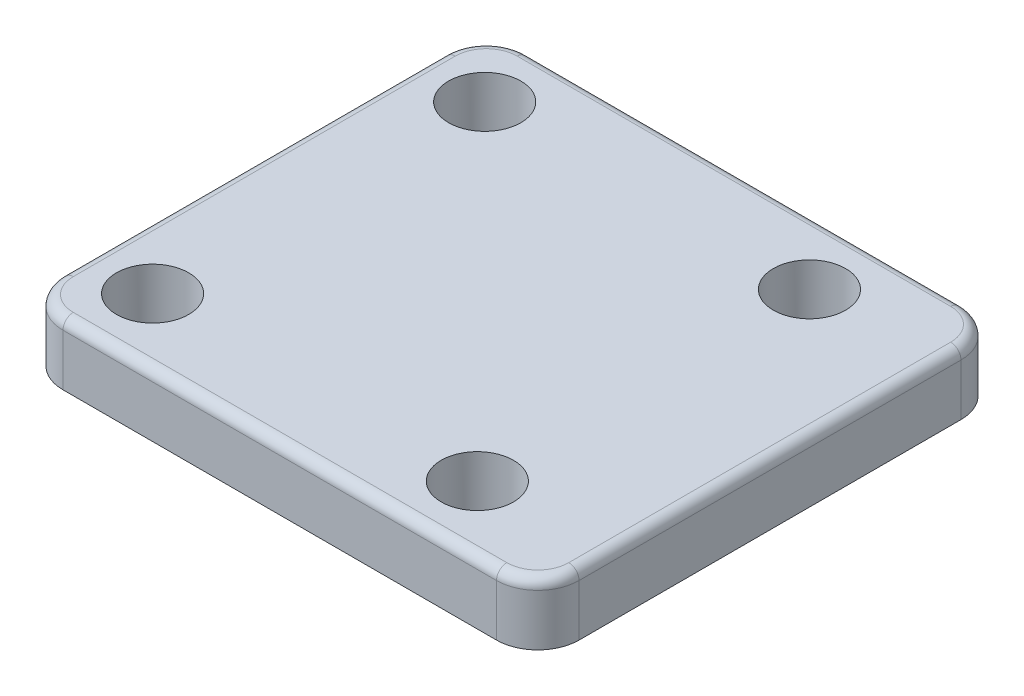
from build123d import *

# Parameters (mm, degrees)
BOSS_EXTRUDE1_DEPTH     = 3
CUT_EXTRUDE2_DEPTH      = 35.165040612
CUT_EXTRUDE2_DEPTH_BACK = 35.165040612
SKETCH2_R               = 3.5
FILLET1_R               = 1
SKETCH3_R               = 16
BOSS_EXTRUDE2_DEPTH     = 2
CHAMFER1_SIZE           = 1


with BuildPart() as part:
    # Sketch1 → Boss-Extrude1 (new, symmetric)
    with BuildSketch(Plane(origin=(0, 0, 0), x_dir=(1, 0, 0), z_dir=(0, 1, 0))):
        with BuildLine():
            Line((21, -22.5), (-21, -22.5))
            ThreePointArc((-21, -22.5), (-23.828427125, -21.328427125), (-25, -18.5))
            Line((-25, -18.5), (-25, 18.5))
            ThreePointArc((-25, 18.5), (-23.828427125, 21.328427125), (-21, 22.5))
            Line((-21, 22.5), (21, 22.5))
            ThreePointArc((21, 22.5), (23.828427125, 21.328427125), (25, 18.5))
            Line((25, 18.5), (25, -18.5))
            ThreePointArc((25, -18.5), (23.828427125, -21.328427125), (21, -22.5))
        make_face()
    extrude(amount=BOSS_EXTRUDE1_DEPTH, both=True)

    # Sketch2 → Cut-Extrude2 (cut, two sides: drawn at the far end of the back side and taken through both)
    with BuildSketch(Plane(origin=(0, 3, 0), x_dir=(1, 0, 0), z_dir=(0, 1, 0)).offset(-CUT_EXTRUDE2_DEPTH_BACK)):
        with Locations(Location((-18.730146718, -16.087650053, 0), (0, 0, 270))):
            Circle(SKETCH2_R)
        with Locations(Location((-18.730146718, 16.087650053, 0), (0, 0, 270))):
            Circle(SKETCH2_R)
        with Locations(Location((12.730146718, 16.087650053, 0), (0, 0, 270))):
            Circle(SKETCH2_R)
        with Locations(Location((12.730146718, -16.087650053, 0), (0, 0, 270))):
            Circle(SKETCH2_R)
    extrude(amount=CUT_EXTRUDE2_DEPTH + CUT_EXTRUDE2_DEPTH_BACK, mode=Mode.SUBTRACT)

    # Fillet1
    fillet1_edges = [part.edges().sort_by_distance(p)[0] for p in [
        (23.828427125, 3, 21.328427125),
        (25, 3, 0),
        (23.828427125, 3, -21.328427125),
        (0, 3, -22.5),
        (-23.828427125, 3, -21.328427125),
        (-25, 3, 0),
        (-23.828427125, 3, 21.328427125),
        (0, 3, 22.5),
    ]]
    fillet(fillet1_edges, radius=FILLET1_R)

    # Sketch3 → Boss-Extrude2 (add)
    with BuildSketch(Plane.XZ.offset(3)):
        with Locations(Location((0, 0, 0), (0, 0, 270))):
            Circle(SKETCH3_R)
    extrude(amount=BOSS_EXTRUDE2_DEPTH)

    # Chamfer1
    chamfer1_edges = [part.edges().sort_by_distance(p)[0] for p in [
        (0, -5, 16),
    ]]
    chamfer(chamfer1_edges, length=CHAMFER1_SIZE)


solid = part.part
